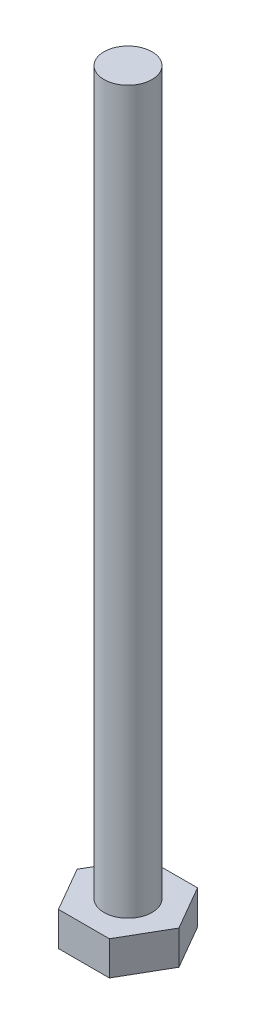
from build123d import *

# Parameters (mm, degrees)
SKETCH_1_R      = 1.5
EXTRUDE_1_DEPTH = 45
EXTRUDE_2_DEPTH = 2.12


with BuildPart() as part:
    # 草图1 → 凸台-拉伸1 (new body)
    with BuildSketch(Plane(origin=(0, 0, 0), x_dir=(1, 0, 0), z_dir=(0, 1, 0))):
        with Locations(Location((0, 0, 0), (0, 0, 90))):
            Circle(SKETCH_1_R)
    extrude(amount=EXTRUDE_1_DEPTH)

    # 草图3 → 凸台-拉伸2 (add)
    with BuildSketch(Plane.XZ):
        Polygon((3.175426481, 0), (1.58771324, 2.75), (-1.58771324, 2.75), (-3.175426481, 0), (-1.58771324, -2.75), (1.58771324, -2.75), align=None)
    extrude(amount=EXTRUDE_2_DEPTH)


solid = part.part
